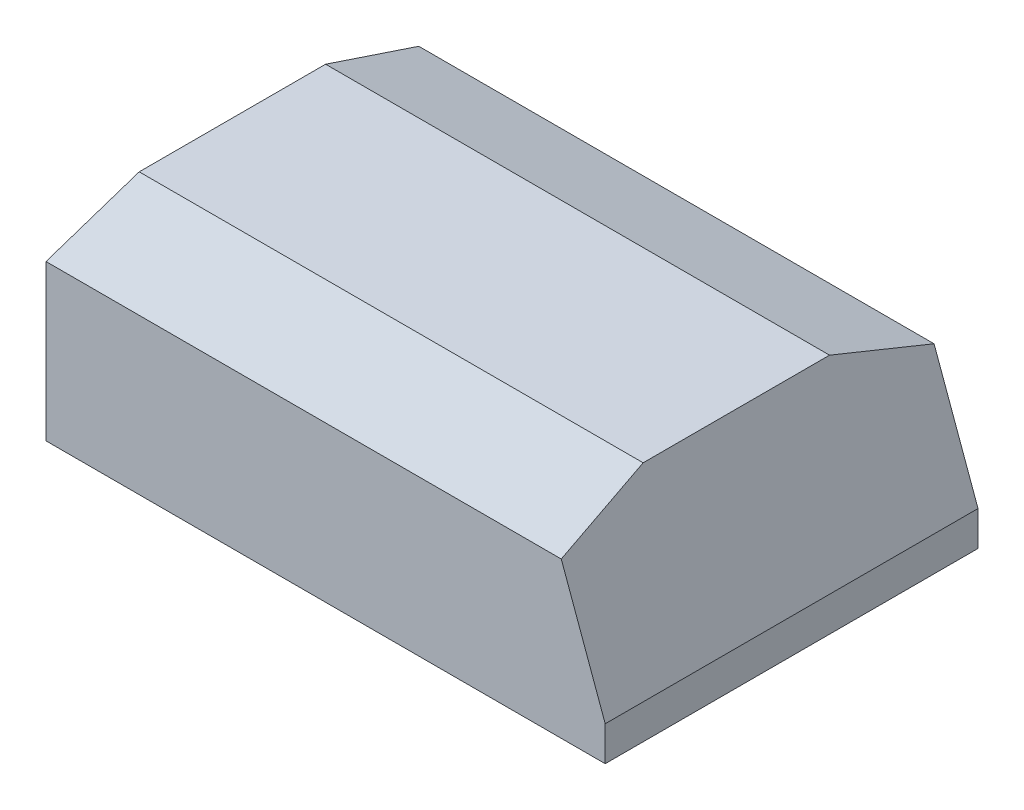
from build123d import *

# Parameters (mm, degrees)
SKETCH1_W               = 90
SKETCH1_H               = 60
BOSS_EXTRUDE1_DEPTH     = 30
CUT_EXTRUDE1_DEPTH      = 62.846584384
CUT_EXTRUDE1_DEPTH_BACK = 62.846584384
CUT_EXTRUDE2_DEPTH      = 100.498743711
CUT_EXTRUDE2_DEPTH_BACK = 100.498743711


with BuildPart() as part:
    # Sketch1 → Boss-Extrude1 (new body)
    with BuildSketch(Plane(origin=(0, 0, 0), x_dir=(1, 0, 0), z_dir=(0, 1, 0))):
        Rectangle(SKETCH1_W, SKETCH1_H)
    extrude(amount=BOSS_EXTRUDE1_DEPTH)

    # Sketch2 → Cut-Extrude1 (cut, two sides: drawn at the far end of the back side and taken through both)
    with BuildSketch(Plane.XY.offset(-CUT_EXTRUDE1_DEPTH_BACK)):
        Polygon((45, 5.56799186), (36.107476274, 30), (45, 30), align=None)
    extrude(amount=CUT_EXTRUDE1_DEPTH + CUT_EXTRUDE1_DEPTH_BACK, mode=Mode.SUBTRACT)

    # Sketch3 → Cut-Extrude2 (cut, two sides: drawn at the far end of the back side and taken through both)
    with BuildSketch(Plane.ZY.offset(45).offset(-CUT_EXTRUDE2_DEPTH_BACK)):
        Polygon((15, 30), (30, 25), (30, 30), align=None)
        Polygon((-30, 25), (-30, 30), (-15, 30), align=None)
    extrude(amount=CUT_EXTRUDE2_DEPTH + CUT_EXTRUDE2_DEPTH_BACK, mode=Mode.SUBTRACT)


solid = part.part
